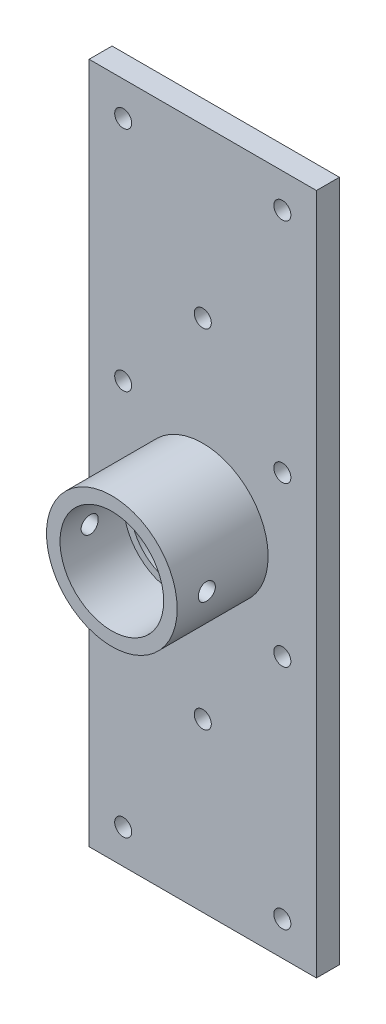
from build123d import *

# Parameters (mm, degrees)
BOSS_EXTRUDE1_DEPTH            = 4.7625
BOSS_EXTRUDE1_DEPTH_BACK       = 1.651
SKETCH1_W                      = 63.5
SKETCH1_H                      = 190.5
SKETCH3_R                      = 6.35
CUT_EXTRUDE1_DEPTH             = 0.508
SKETCH4_R                      = 18.25625
BOSS_EXTRUDE2_DEPTH            = 38.1
SKETCH5_R                      = 12.461875
CUT_EXTRUDE2_DEPTH             = 38.1
SKETCH7_R                      = 14.2875
CUT_EXTRUDE3_DEPTH             = 30.48
F_3_16_0_1875_DIAMETER_HOLE1_D = 4.7625
SKETCH13_R                     = 14.478
CUT_EXTRUDE4_DEPTH             = 30.48
CUT_EXTRUDE5_START             = -12.7
SKETCH14_R                     = 18.25625
CUT_EXTRUDE5_DEPTH             = 12.7
F_3_16_0_1875_DIAMETER_HOLE3_D = 4.7625


with BuildPart() as part:
    # Sketch1 → Boss-Extrude1 (new, two sides: drawn at the far end of the back side and taken through both)
    with BuildSketch(Plane.XY.offset(-BOSS_EXTRUDE1_DEPTH_BACK)):
        Rectangle(SKETCH1_W, SKETCH1_H)
    extrude(amount=BOSS_EXTRUDE1_DEPTH + BOSS_EXTRUDE1_DEPTH_BACK)

    # Sketch3 → Cut-Extrude1 (cut)
    with BuildSketch(Plane.XY.offset(4.7625)):
        Circle(SKETCH3_R)
    extrude(amount=-CUT_EXTRUDE1_DEPTH, mode=Mode.SUBTRACT)

    # Sketch4 → Boss-Extrude2 (add)
    with BuildSketch(Plane.XY.offset(4.7625)):
        with Locations(Location((0, 0, 0), (0, 0, 180))):
            Circle(SKETCH4_R)
    extrude(amount=BOSS_EXTRUDE2_DEPTH)

    # Sketch5 → Cut-Extrude2 (cut)
    with BuildSketch(Plane.XY.offset(42.8625)):
        Circle(SKETCH5_R)
    extrude(amount=-CUT_EXTRUDE2_DEPTH, mode=Mode.SUBTRACT)

    # Sketch7 → Cut-Extrude3 (cut)
    with BuildSketch(Plane.XY.offset(42.8625)):
        Circle(SKETCH7_R)
    extrude(amount=-CUT_EXTRUDE3_DEPTH, mode=Mode.SUBTRACT)

    # 3/16 (0.1875) Diameter Hole1 (through all)
    with Locations(Plane.XY.offset(4.7625)):
        with Locations((-22.225, 85.725), (-22.225, -85.725), (22.225, -85.725), (22.225, 85.725), (0, 48.514), (0, -48.514), (-22.225, 22.225), (-22.225, -22.225), (22.225, -22.225), (22.225, 22.225)):
            Hole(F_3_16_0_1875_DIAMETER_HOLE1_D / 2)

    # Sketch13 → Cut-Extrude4 (cut)
    with BuildSketch(Plane.XY.offset(42.8625)):
        Circle(SKETCH13_R)
    extrude(amount=-CUT_EXTRUDE4_DEPTH, mode=Mode.SUBTRACT)

    # Sketch14 → Cut-Extrude5 (cut)
    with BuildSketch(Plane.XY.offset(42.8625).offset(CUT_EXTRUDE5_START)):
        with Locations(Location((0, 0, 0), (0, 0, 180))):
            Circle(SKETCH14_R)
    extrude(amount=CUT_EXTRUDE5_DEPTH, mode=Mode.SUBTRACT)

    # 3/16 (0.1875) Diameter Hole3 (through all)
    with Locations(Plane(origin=(18.25625, 0, 21.873504095), x_dir=(0, 1, 0), z_dir=(1, 0, 0))):
        with Locations((0, 0)):
            Hole(F_3_16_0_1875_DIAMETER_HOLE3_D / 2)


solid = part.part
